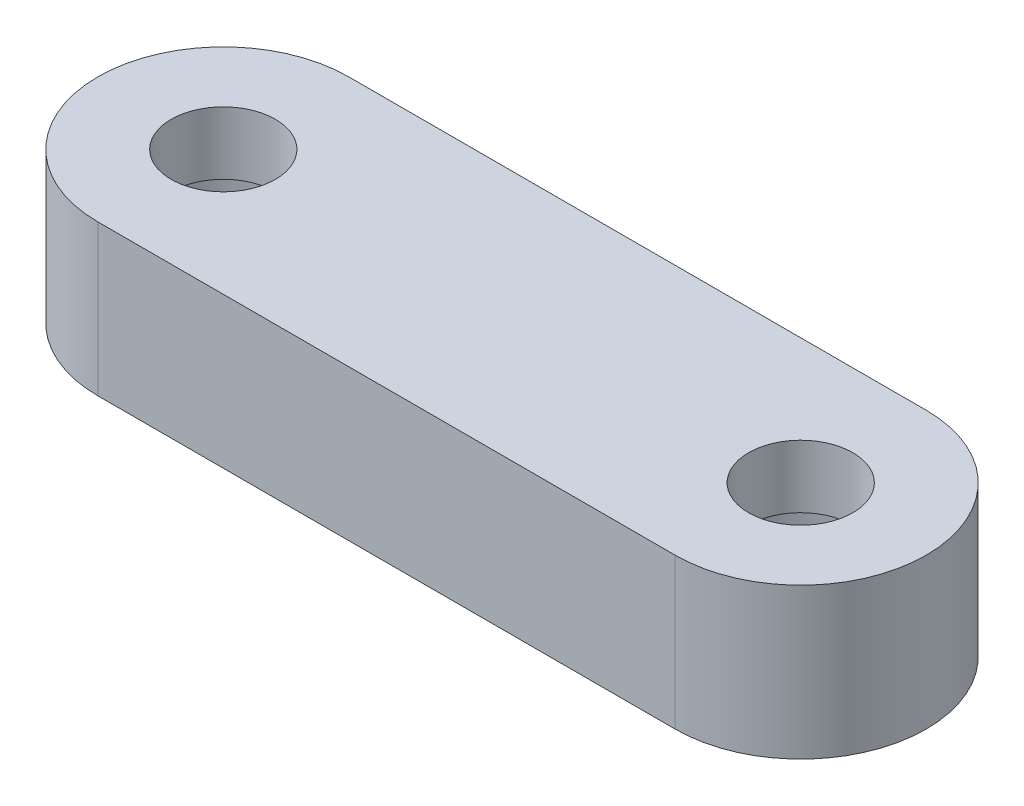
from build123d import *

# Parameters (mm, degrees)
EXTRUDE_1_DEPTH = 6


with BuildPart() as part:
    # 草图1 → 凸台-拉伸1 (new body)
    with BuildSketch(Plane(origin=(0, 0, 0), x_dir=(1, 0, 0), z_dir=(0, 1, 0))):
        with BuildLine():
            Line((0, 5), (23, 5))
            ThreePointArc((23, 5), (28, 0), (23, -5))
            Line((23, -5), (0, -5))
            ThreePointArc((0, -5), (-5, 0), (0, 5))
        make_face()
    extrude(amount=EXTRUDE_1_DEPTH)

    # 草图2 → 切除-旋转1 (revolve, cut)
    with BuildSketch(Plane.XY, mode=Mode.PRIVATE) as cut_revolve_1_sk:
        Polygon((0, 0), (-3.75, 0), (-3.75, 3.5), (-2.075, 3.5), (-2.075, 6), (0, 6), align=None)
    revolve(cut_revolve_1_sk.sketch.rotate(Axis((0, 0, 0), (0, 1, 0)), 270), axis=Axis((0, 0, 0), (0, 1, 0)), mode=Mode.SUBTRACT)

    # 草图3 → 切除-旋转2 (revolve, cut)
    with BuildSketch(Plane.XY, mode=Mode.PRIVATE) as cut_revolve_2_sk:
        Polygon((23, 0), (19.25, 0), (19.25, 3.5), (20.925, 3.5), (20.925, 6), (23, 6), align=None)
    revolve(cut_revolve_2_sk.sketch.rotate(Axis((23, 6, 0), (0, -1, 0)), 270), axis=Axis((23, 6, 0), (0, -1, 0)), mode=Mode.SUBTRACT)


solid = part.part
